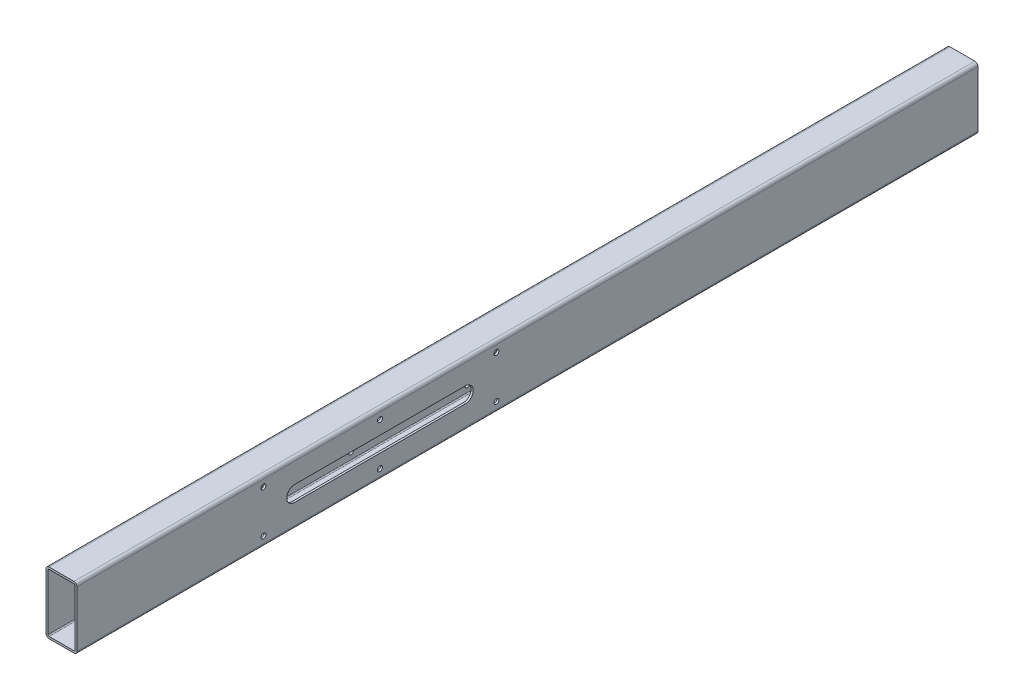
from build123d import *

# Parameters (mm, degrees)
EXTRUDE_THIN1_DEPTH = 736.6
CUT_EXTRUDE2_DEPTH  = 738.475341961
SKETCH5_R           = 2.0193
CUT_EXTRUDE3_DEPTH  = 738.475341961


with BuildPart() as part:
    # Sketch1 → Extrude-Thin1 (new body)
    with BuildSketch(Plane.XY):
        with BuildLine():
            Line((-10.16, 25.4), (10.16, 25.4))
            ThreePointArc((10.16, 25.4), (11.956051224, 24.656051224), (12.7, 22.86))
            Line((12.7, 22.86), (12.7, -22.86))
            ThreePointArc((12.7, -22.86), (11.956051224, -24.656051224), (10.16, -25.4))
            Line((10.16, -25.4), (-10.16, -25.4))
            ThreePointArc((-10.16, -25.4), (-11.956051224, -24.656051224), (-12.7, -22.86))
            Line((-12.7, -22.86), (-12.7, 22.86))
            ThreePointArc((-12.7, 22.86), (-11.956051224, 24.656051224), (-10.16, 25.4))
        make_face()
        with BuildLine():
            Line((-10.16, 23.749), (10.16, 23.749))
            ThreePointArc((10.16, 23.749), (10.788617928, 23.488617928), (11.049, 22.86))
            Line((11.049, 22.86), (11.049, -22.86))
            ThreePointArc((11.049, -22.86), (10.788617928, -23.488617928), (10.16, -23.749))
            Line((10.16, -23.749), (-10.16, -23.749))
            ThreePointArc((-10.16, -23.749), (-10.788617928, -23.488617928), (-11.049, -22.86))
            Line((-11.049, -22.86), (-11.049, 22.86))
            ThreePointArc((-11.049, 22.86), (-10.788617928, 23.488617928), (-10.16, 23.749))
        make_face(mode=Mode.SUBTRACT)
    extrude(amount=EXTRUDE_THIN1_DEPTH)

    # Sketch3 → Cut-Extrude2 (cut, through all)
    with BuildSketch(Plane.ZY.offset(12.7)):
        with BuildLine():
            Line((558.8, -6.35), (419.1, -6.35))
            ThreePointArc((419.1, -6.35), (412.75, 0), (419.1, 6.35))
            Line((419.1, 6.35), (558.8, 6.35))
            ThreePointArc((558.8, 6.35), (565.15, 0), (558.8, -6.35))
        make_face()
    extrude(amount=-CUT_EXTRUDE2_DEPTH, mode=Mode.SUBTRACT)

    # Sketch5 → Cut-Extrude3 (cut, through all)
    with BuildSketch(Plane(origin=(12.7, 0, 0), x_dir=(0, 0, -1), z_dir=(1, 0, 0))):
        with Locations((-393.7, 17.399)):
            Circle(SKETCH5_R)
        with Locations((-393.7, -17.399)):
            Circle(SKETCH5_R)
        with Locations((-488.95, 17.399)):
            Circle(SKETCH5_R)
        with Locations((-488.95, -17.399)):
            Circle(SKETCH5_R)
        with Locations((-584.2, -17.399)):
            Circle(SKETCH5_R)
        with Locations((-584.2, 17.399)):
            Circle(SKETCH5_R)
    extrude(amount=-CUT_EXTRUDE3_DEPTH, mode=Mode.SUBTRACT)


solid = part.part
